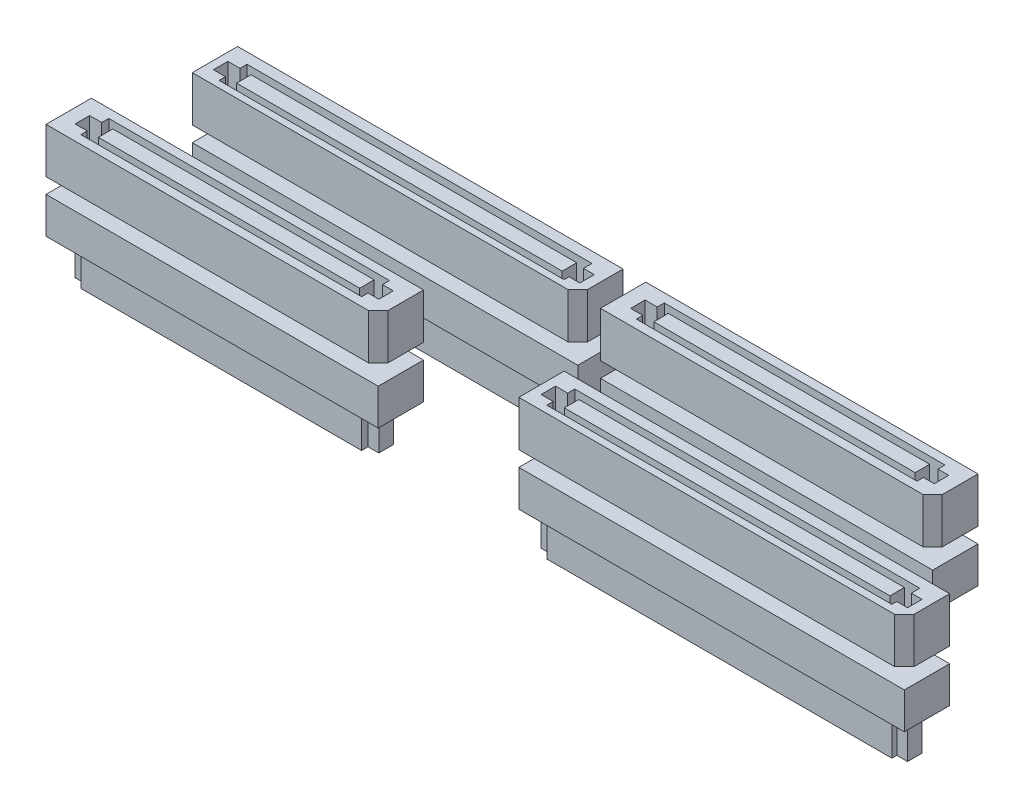
from build123d import *

# Parameters (mm, degrees)
SV_DEPTH           = 5
SV_2_DEPTH         = 5
SV_3_DEPTH         = 5
SV_4_DEPTH         = 5
SKETCH3_W          = 28.811718275
SKETCH3_H          = 1.597828601
SKETCH3_W_2        = 35.897762959
SKETCH3_W_3        = 35.897762958
CUT_EXTRUDE1_DEPTH = 4
SV4_A_DEPTH        = 4
SV4_A_2_DEPTH      = 4
SV4_A_3_DEPTH      = 4
SV4_A_4_DEPTH      = 4
SKETCH7_W          = 35.897762958
SKETCH7_H          = 1.597828601
SV4_B_DEPTH        = 4
SKETCH7_W_2        = 28.811718275
SV4_B_2_DEPTH      = 4
SKETCH7_W_3        = 35.897762959
SV4_B_3_DEPTH      = 4
SV4_B_4_DEPTH      = 4


with BuildPart() as part:
    # Sketch1 → SV (new body)
    with BuildSketch(Plane(origin=(0, 0, 0), x_dir=(1, 0, 0), z_dir=(0, 1, 0))):
        Polygon((55.811, 9.5), (97.25, 9.5), (97.25, 5.56), (96.19, 4.5), (54.75, 4.5), (54.75, 8.439), (54.75, 9.5), align=None)
    extrude(amount=SV_DEPTH)


with BuildPart() as body_2:
    # Sketch1 → SV 2 (new body)
    with BuildSketch(Plane(origin=(0, 0, 0), x_dir=(1, 0, 0), z_dir=(0, 1, 0))):
        Polygon((3.686, 9.5), (39.25, 9.5), (39.25, 5.555), (38.195, 4.5), (2.625, 4.5), (2.625, 8.439), (2.625, 9.5), align=None)
    extrude(amount=SV_2_DEPTH)


with BuildPart() as body_3:
    # Sketch1 → SV 3 (new body)
    with BuildSketch(Plane(origin=(0, 0, 0), x_dir=(1, 0, 0), z_dir=(0, 1, 0))):
        Polygon((51.811, 22.5), (87.375, 22.5), (87.375, 18.555), (86.32, 17.5), (50.75, 17.5), (50.75, 21.439), (50.75, 22.5), align=None)
    extrude(amount=SV_3_DEPTH)


with BuildPart() as body_4:
    # Sketch1 → SV 4 (new body)
    with BuildSketch(Plane(origin=(0, 0, 0), x_dir=(1, 0, 0), z_dir=(0, 1, 0))):
        Polygon((6.811, 22.5), (48.25, 22.5), (48.25, 18.56), (47.19, 17.5), (5.75, 17.5), (5.75, 21.439), (5.75, 22.5), align=None)
    extrude(amount=SV_4_DEPTH)


with BuildPart() as cut_extrude1_tool:
    # Sketch3 → Cut-Extrude1 (new body)
    # profile 1 of 4: a face of its own
    with BuildSketch(Plane(origin=(0, 5, 0), x_dir=(1, 0, 0), z_dir=(0, 1, 0))):
        Polygon((4.189336253, 7.745735487), (5.524337048, 7.745735487), (5.524337048, 8.524173538), (36.475691419, 8.524173538), (36.475691419, 7.745735487), (37.666991912, 7.745735487), (37.666991912, 6.147906886), (36.475691419, 6.147906886), (36.475691419, 5.438560322), (5.524337048, 5.438560322), (5.524337048, 6.147906886), (4.189336253, 6.147906886), align=None)
        with Locations((21.152985591, 6.946821187)):
            Rectangle(SKETCH3_W, SKETCH3_H, mode=Mode.SUBTRACT)
    # profile 2 of 4: a face of its own
    with BuildSketch(Plane(origin=(0, 5, 0), x_dir=(1, 0, 0), z_dir=(0, 1, 0))):
        Polygon((52.421116037, 20.753597434), (53.756116831, 20.753597434), (53.756116831, 21.532035485), (84.707471203, 21.532035485), (84.707471203, 20.753597434), (85.898771695, 20.753597434), (85.898771695, 19.155768833), (84.707471203, 19.155768833), (84.707471203, 18.446422269), (53.756116831, 18.446422269), (53.756116831, 19.155768833), (52.421116037, 19.155768833), align=None)
        with Locations((69.384765375, 19.954683133)):
            Rectangle(SKETCH3_W, SKETCH3_H, mode=Mode.SUBTRACT)
    # profile 3 of 4: a face of its own
    with BuildSketch(Plane(origin=(0, 5, 0), x_dir=(1, 0, 0), z_dir=(0, 1, 0))):
        Polygon((55.705906871, 7.599031898), (57.040907666, 7.599031898), (57.040907666, 8.377469948), (95.07830672, 8.377469948), (95.07830672, 7.437727621), (96.269607213, 7.437727621), (96.269607213, 5.83989902), (95.07830672, 5.83989902), (95.07830672, 5.291856733), (57.040907666, 5.291856733), (57.040907666, 6.001203297), (55.705906871, 6.001203297), align=None)
        with Locations((76.21257855, 6.800117597)):
            Rectangle(SKETCH3_W_2, SKETCH3_H, mode=Mode.SUBTRACT)
    # profile 4 of 4: a face of its own
    with BuildSketch(Plane(origin=(0, 5, 0), x_dir=(1, 0, 0), z_dir=(0, 1, 0))):
        Polygon((6.636601859, 20.53972103), (7.971602653, 20.53972103), (7.971602653, 21.318159081), (46.009001708, 21.318159081), (46.009001708, 20.378416754), (47.2003022, 20.378416754), (47.2003022, 18.780588153), (46.009001708, 18.780588153), (46.009001708, 18.232545866), (7.971602653, 18.232545866), (7.971602653, 18.941892429), (6.636601859, 18.941892429), align=None)
        with Locations((27.143273538, 19.74080673)):
            Rectangle(SKETCH3_W_3, SKETCH3_H, mode=Mode.SUBTRACT)
    extrude(amount=-CUT_EXTRUDE1_DEPTH)


with BuildPart() as part_1:
    add(part.part)

    # Cut-Extrude1: cut by cut_extrude1_tool
    add(cut_extrude1_tool.part, mode=Mode.SUBTRACT)


with BuildPart() as body_2_1:
    add(body_2.part)

    # Cut-Extrude1: cut by cut_extrude1_tool
    add(cut_extrude1_tool.part, mode=Mode.SUBTRACT)


with BuildPart() as body_3_1:
    add(body_3.part)

    # Cut-Extrude1: cut by cut_extrude1_tool
    add(cut_extrude1_tool.part, mode=Mode.SUBTRACT)


with BuildPart() as body_4_1:
    add(body_4.part)

    # Cut-Extrude1: cut by cut_extrude1_tool
    add(cut_extrude1_tool.part, mode=Mode.SUBTRACT)


with BuildPart() as body_5:
    # Sketch6 → SV4(a) (new body)
    with BuildSketch(Plane(origin=(0, -1.68656, 0), x_dir=(1, 0, 0), z_dir=(0, 1, 0))):
        Polygon((2.625, 4.5), (38.195, 4.5), (39.25, 4.5), (39.25, 5.555), (39.25, 9.5), (3.685, 9.5), (2.625, 8.44), align=None)
    extrude(amount=-SV4_A_DEPTH)


with BuildPart() as body_6:
    # Sketch6 → SV4_a 2 (new body)
    with BuildSketch(Plane(origin=(0, -1.68656, 0), x_dir=(1, 0, 0), z_dir=(0, 1, 0))):
        Polygon((48.25, 18.56191605), (48.25, 22.5), (6.81, 22.5), (5.75, 21.44), (5.75, 17.5), (47.18808395, 17.5), (48.25, 17.5), align=None)
    extrude(amount=-SV4_A_2_DEPTH)


with BuildPart() as body_7:
    # Sketch6 → SV4_a 3 (new body)
    with BuildSketch(Plane(origin=(0, -1.68656, 0), x_dir=(1, 0, 0), z_dir=(0, 1, 0))):
        Polygon((54.75, 4.5), (96.19, 4.5), (97.25, 4.5), (97.25, 5.56), (97.25, 9.5), (55.81, 9.5), (54.75, 8.44), align=None)
    extrude(amount=-SV4_A_3_DEPTH)


with BuildPart() as body_8:
    # Sketch6 → SV4_a 4 (new body)
    with BuildSketch(Plane(origin=(0, -1.68656, 0), x_dir=(1, 0, 0), z_dir=(0, 1, 0))):
        Polygon((50.75, 17.5), (86.32, 17.5), (87.375, 17.5), (87.375, 18.555), (87.375, 22.5), (51.805, 22.5), (50.75, 21.445), align=None)
    extrude(amount=-SV4_A_4_DEPTH)


with BuildPart() as body_9:
    # Sketch7 → SV4(b) (new body)
    with BuildSketch(Plane.XZ.offset(5.68656)):
        Polygon((7.971602653, -21.318159081), (7.971602653, -20.53972103), (6.636601859, -20.53972103), (6.636601859, -18.941892429), (7.971602653, -18.941892429), (7.971602653, -18.232545866), (46.009001708, -18.232545866), (46.009001708, -18.780588153), (47.2003022, -18.780588153), (47.2003022, -20.378416754), (46.009001708, -20.378416754), (46.009001708, -21.318159081), align=None)
        with Locations((27.143273538, -19.74080673)):
            Rectangle(SKETCH7_W, SKETCH7_H, mode=Mode.SUBTRACT)
    extrude(amount=SV4_B_DEPTH)


with BuildPart() as body_10:
    # Sketch7 → SV4_b 2 (new body)
    with BuildSketch(Plane.XZ.offset(5.68656)):
        Polygon((53.756116831, -21.532035485), (84.707471203, -21.532035485), (84.707471203, -20.753597434), (85.898771695, -20.753597434), (85.898771695, -19.155768833), (84.707471203, -19.155768833), (84.707471203, -18.446422269), (53.756116831, -18.446422269), (53.756116831, -19.155768833), (52.421116037, -19.155768833), (52.421116037, -20.753597434), (53.756116831, -20.753597434), align=None)
        with Locations((69.384765375, -19.954683133)):
            Rectangle(SKETCH7_W_2, SKETCH7_H, mode=Mode.SUBTRACT)
    extrude(amount=SV4_B_2_DEPTH)


with BuildPart() as body_11:
    # Sketch7 → SV4_b 3 (new body)
    with BuildSketch(Plane.XZ.offset(5.68656)):
        Polygon((57.040907666, -8.377469948), (57.040907666, -7.599031898), (55.705906871, -7.599031898), (55.705906871, -6.001203297), (57.040907666, -6.001203297), (57.040907666, -5.291856733), (95.07830672, -5.291856733), (95.07830672, -5.83989902), (96.269607213, -5.83989902), (96.269607213, -7.437727621), (95.07830672, -7.437727621), (95.07830672, -8.377469948), align=None)
        with Locations((76.21257855, -6.800117597)):
            Rectangle(SKETCH7_W_3, SKETCH7_H, mode=Mode.SUBTRACT)
    extrude(amount=SV4_B_3_DEPTH)


with BuildPart() as body_12:
    # Sketch7 → SV4_b 4 (new body)
    with BuildSketch(Plane.XZ.offset(5.68656)):
        Polygon((4.189336253, -6.147906886), (5.524337048, -6.147906886), (5.524337048, -5.438560322), (36.475691419, -5.438560322), (36.475691419, -6.147906886), (37.666991912, -6.147906886), (37.666991912, -7.745735487), (36.475691419, -7.745735487), (36.475691419, -8.524173538), (5.524337048, -8.524173538), (5.524337048, -7.745735487), (4.189336253, -7.745735487), align=None)
        with Locations((21.152985591, -6.946821187)):
            Rectangle(SKETCH7_W_2, SKETCH7_H, mode=Mode.SUBTRACT)
    extrude(amount=SV4_B_4_DEPTH)


solid = Compound([part_1.part, body_2_1.part, body_3_1.part, body_4_1.part, body_5.part, body_6.part, body_7.part, body_8.part, body_9.part, body_10.part, body_11.part, body_12.part])
